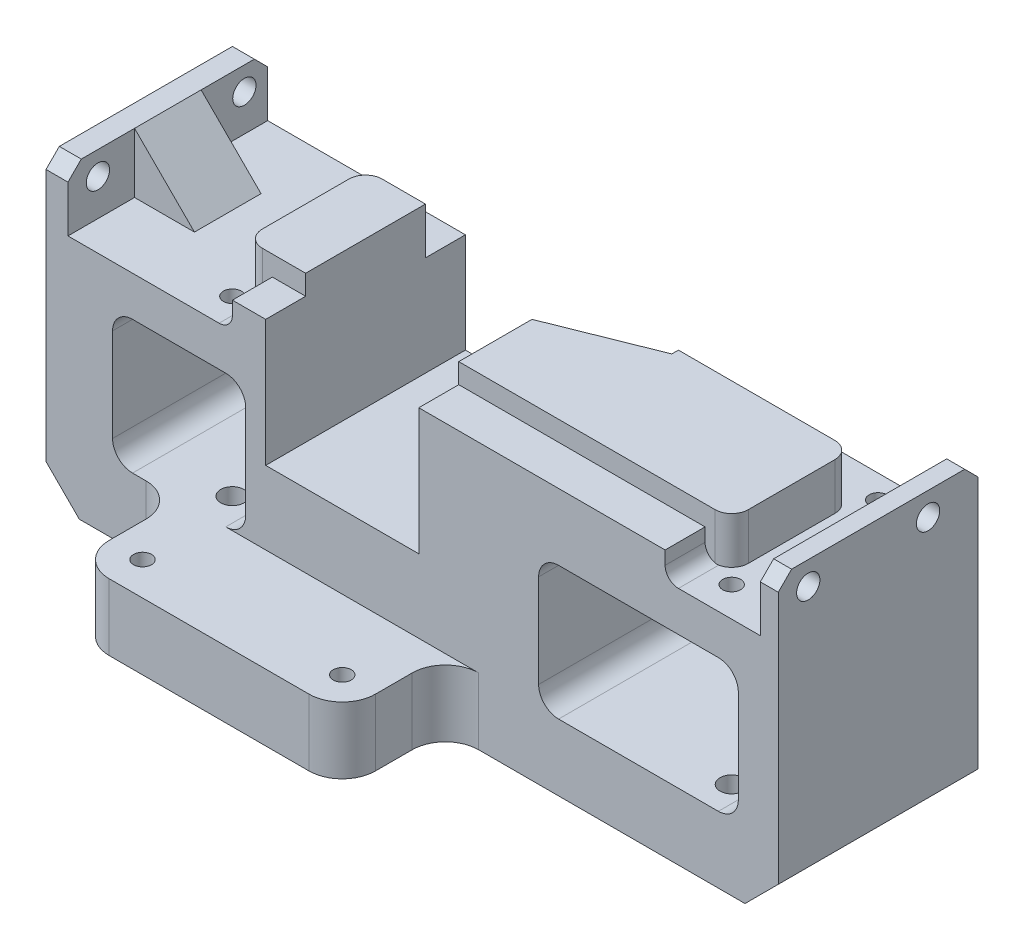
from build123d import *

# Parameters (mm, degrees)
SKETCH_1_R          = 1.35
EXTRUDE_1_DEPTH     = 10
SKETCH_2_W          = 110
SKETCH_2_H          = 30
EXTRUDE_2_DEPTH     = 26
CUT_EXTRUDE_1_DEPTH = 76.432088663
EXTRUDE_3_DEPTH     = 7
SKETCH_5_R          = 1.35
CUT_EXTRUDE_2_DEPTH = 7
SKETCH_6_W          = 65
SKETCH_6_H          = 6
EXTRUDE_4_DEPTH     = 4
SKETCH_7_W          = 3.3
SKETCH_7_H          = 30
SKETCH_7_W_2        = 2.7
EXTRUDE_5_DEPTH     = 9
RIB_1_REACH         = 79.332
SKETCH_8_WALL_W     = 169.39207434
SKETCH_8_WALL_H     = 10
RIB_2_REACH         = 79.332
SKETCH_9_WALL_W     = 167.056457124
SKETCH_9_WALL_H     = 10
CUT_EXTRUDE_3_REACH = 124.7
SKETCH_10_R         = 1.75
CUT_EXTRUDE_4_REACH = 124.7
SKETCH_11_R         = 1.75
FILLET_1_R          = 2
CUT_EXTRUDE_5_DEPTH = 22
CHAMFER_1_SIZE      = 5
CHAMFER_2_SIZE      = 2
SKETCH_13_R         = 1.75
CUT_EXTRUDE_6_DEPTH = 72.973953622
CHAMFER_3_SIZE      = 5
SKETCH_14_R         = 3
CUT_EXTRUDE_7_DEPTH = 4


with BuildPart() as part:
    # 草图1 → 凸台-拉伸1 (new body)
    with BuildSketch(Plane(origin=(0, 0, 0), x_dir=(1, 0, 0), z_dir=(0, 1, 0))):
        with BuildLine():
            Line((10, 15), (55, 15))
            Line((55, 15), (55, -15))
            Line((55, -15), (10, -15))
            ThreePointArc((10, -15), (6.464466094, -16.464466094), (5, -20))
            Line((5, -20), (5, -25.5))
            ThreePointArc((5, -25.5), (3.535533906, -29.035533906), (0, -30.5))
            Line((0, -30.5), (-30, -30.5))
            ThreePointArc((-30, -30.5), (-33.535533906, -29.035533906), (-35, -25.5))
            Line((-35, -25.5), (-35, -20))
            ThreePointArc((-35, -20), (-36.464466094, -16.464466094), (-40, -15))
            Line((-40, -15), (-55, -15))
            Line((-55, -15), (-55, 15))
            Line((-55, 15), (-40, 15))
            ThreePointArc((-40, 15), (-36.464466094, 16.464466094), (-35, 20))
            Line((-35, 20), (-35, 22))
            Line((-35, 22), (5, 22))
            Line((5, 22), (5, 20))
            ThreePointArc((5, 20), (6.464466094, 16.464466094), (10, 15))
        make_face()
        with Locations(Location((-30, 14.5, 0), (0, 0, 270))):
            Circle(SKETCH_1_R, mode=Mode.SUBTRACT)
        with Locations(Location((0, 14.5, 0), (0, 0, 270))):
            Circle(SKETCH_1_R, mode=Mode.SUBTRACT)
        with Locations(Location((0, -25.5, 0), (0, 0, 270))):
            Circle(SKETCH_1_R, mode=Mode.SUBTRACT)
        with Locations(Location((-30, -25.5, 0), (0, 0, 270))):
            Circle(SKETCH_1_R, mode=Mode.SUBTRACT)
    extrude(amount=EXTRUDE_1_DEPTH)

    # 草图2 → 凸台-拉伸2 (add)
    with BuildSketch(Plane(origin=(0, 10, 0), x_dir=(1, 0, 0), z_dir=(0, 1, 0))):
        Rectangle(SKETCH_2_W, SKETCH_2_H)
    extrude(amount=EXTRUDE_2_DEPTH)

    # 草图3 → 切除-拉伸1 (cut, through all)
    with BuildSketch(Plane.XY.offset(15)):
        with BuildLine():
            Line((-42, 30), (-28, 30))
            ThreePointArc((-28, 30), (-25.878679656, 29.121320344), (-25, 27))
            Line((-25, 27), (-25, 13))
            ThreePointArc((-25, 13), (-25.878679656, 10.878679656), (-28, 10))
            Line((-28, 10), (-42, 10))
            ThreePointArc((-42, 10), (-44.121320344, 10.878679656), (-45, 13))
            Line((-45, 13), (-45, 27))
            ThreePointArc((-45, 27), (-44.121320344, 29.121320344), (-42, 30))
        make_face()
        with BuildLine():
            Line((22, 10), (46, 10))
            ThreePointArc((46, 10), (48.121320344, 10.878679656), (49, 13))
            Line((49, 13), (49, 27))
            ThreePointArc((49, 27), (48.121320344, 29.121320344), (46, 30))
            Line((46, 30), (22, 30))
            ThreePointArc((22, 30), (19.878679656, 29.121320344), (19, 27))
            Line((19, 27), (19, 13))
            ThreePointArc((19, 13), (19.878679656, 10.878679656), (22, 10))
        make_face()
    extrude(amount=-CUT_EXTRUDE_1_DEPTH, mode=Mode.SUBTRACT)

    # 草图4 → 凸台-拉伸3 (add)
    with BuildSketch(Plane(origin=(0, 36, 0), x_dir=(1, 0, 0), z_dir=(0, 1, 0))):
        with BuildLine():
            Line((-28.5, 9), (39.5, 9))
            ThreePointArc((39.5, 9), (41.267766953, 8.267766953), (42, 6.5))
            Line((42, 6.5), (42, -6.5))
            ThreePointArc((42, -6.5), (41.267766953, -8.267766953), (39.5, -9))
            Line((39.5, -9), (-28.5, -9))
            ThreePointArc((-28.5, -9), (-30.267766953, -8.267766953), (-31, -6.5))
            Line((-31, -6.5), (-31, 6.5))
            ThreePointArc((-31, 6.5), (-30.267766953, 8.267766953), (-28.5, 9))
        make_face()
    extrude(amount=EXTRUDE_3_DEPTH)

    # 草图5 → 切除-拉伸2 (cut)
    with BuildSketch(Plane(origin=(0, 36, 0), x_dir=(1, 0, 0), z_dir=(0, 1, 0))):
        with Locations(Location((43.5, 11.5, 0), (0, 0, 270))):
            Circle(SKETCH_5_R)
        with Locations(Location((43.5, -10.5, 0), (0, 0, 270))):
            Circle(SKETCH_5_R)
        with Locations(Location((-31.5, -10.5, 0), (0, 0, 270))):
            Circle(SKETCH_5_R)
        with Locations(Location((-31.5, 11.5, 0), (0, 0, 270))):
            Circle(SKETCH_5_R)
    extrude(amount=-CUT_EXTRUDE_2_DEPTH, mode=Mode.SUBTRACT)

    # 草图6 → 凸台-拉伸4 (add)
    with BuildSketch(Plane(origin=(0, 36, 0), x_dir=(1, 0, 0), z_dir=(0, 1, 0))):
        with Locations((5.5, -12)):
            Rectangle(SKETCH_6_W, SKETCH_6_H)
    extrude(amount=EXTRUDE_4_DEPTH)

    # 草图7 → 凸台-拉伸5 (add)
    with BuildSketch(Plane(origin=(0, 36, 0), x_dir=(1, 0, 0), z_dir=(0, 1, 0))):
        with Locations((-53.35, 0)):
            Rectangle(SKETCH_7_W, SKETCH_7_H)
        with Locations((53.65, 0)):
            Rectangle(SKETCH_7_W_2, SKETCH_7_H)
    extrude(amount=EXTRUDE_5_DEPTH)

    # 草图8 wall → 筋1 (add, up to next)
    with BuildSketch(Plane(origin=(-47.2, 40.5, 0), x_dir=(0.707106781187, -0.707106781187, 0), z_dir=(0.707106781187, 0.707106781187, 0)), mode=Mode.PRIVATE) as rib_1_sk1:
        Rectangle(SKETCH_8_WALL_W, SKETCH_8_WALL_H)
    rib_1_tool1 = extrude(rib_1_sk1.sketch, amount=-RIB_1_REACH, mode=Mode.PRIVATE) - part.part
    add(rib_1_tool1.solids().sort_by_distance((-47.2, 40.5, 0))[0])

    # 草图9 wall → 筋2 (add, up to next)
    with BuildSketch(Plane(origin=(49.701923788, 40.5, 0), x_dir=(-0.500000000021, -0.866025403772, 0), z_dir=(0.866025403772, -0.500000000021, 0)), mode=Mode.PRIVATE) as rib_2_sk1:
        Rectangle(SKETCH_9_WALL_W, SKETCH_9_WALL_H)
    rib_2_tool1 = extrude(rib_2_sk1.sketch, amount=RIB_2_REACH, mode=Mode.PRIVATE) - part.part
    add(rib_2_tool1.solids().sort_by_distance((49.701923788, 40.5, 0))[0])

    # 草图10 → 切除-拉伸3 (cut, up to next)
    with BuildSketch(Plane(origin=(55, 0, 0), x_dir=(0, 0, -1), z_dir=(1, 0, 0)), mode=Mode.PRIVATE) as cut_extrude_3_sk1:
        with Locations((-10.5, 41.5)):
            Circle(SKETCH_10_R)
    cut_extrude_3_tool1 = extrude(cut_extrude_3_sk1.sketch, amount=-CUT_EXTRUDE_3_REACH, mode=Mode.PRIVATE) & part.part
    # 草图10 → 切除-拉伸3 (cut, up to next)
    with BuildSketch(Plane(origin=(55, 0, 0), x_dir=(0, 0, -1), z_dir=(1, 0, 0)), mode=Mode.PRIVATE) as cut_extrude_3_sk2:
        with Locations((7.5, 41.5)):
            Circle(SKETCH_10_R)
    cut_extrude_3_tool2 = extrude(cut_extrude_3_sk2.sketch, amount=-CUT_EXTRUDE_3_REACH, mode=Mode.PRIVATE) & part.part
    add(cut_extrude_3_tool1.solids().sort_by_distance((55, 41.5, 10.5))[0], mode=Mode.SUBTRACT)
    add(cut_extrude_3_tool2.solids().sort_by_distance((55, 41.5, -7.5))[0], mode=Mode.SUBTRACT)

    # 草图11 → 切除-拉伸4 (cut, up to next)
    with BuildSketch(Plane.ZY.offset(55), mode=Mode.PRIVATE) as cut_extrude_4_sk1:
        with Locations(Location((10.5, 41.5, 0), (0, 0, 180))):
            Circle(SKETCH_11_R)
    cut_extrude_4_tool1 = extrude(cut_extrude_4_sk1.sketch, amount=-CUT_EXTRUDE_4_REACH, mode=Mode.PRIVATE) & part.part
    # 草图11 → 切除-拉伸4 (cut, up to next)
    with BuildSketch(Plane.ZY.offset(55), mode=Mode.PRIVATE) as cut_extrude_4_sk2:
        with Locations((-11.5, 41.5)):
            Circle(SKETCH_11_R)
    cut_extrude_4_tool2 = extrude(cut_extrude_4_sk2.sketch, amount=-CUT_EXTRUDE_4_REACH, mode=Mode.PRIVATE) & part.part
    add(cut_extrude_4_tool1.solids().sort_by_distance((-55, 41.5, 10.5))[0], mode=Mode.SUBTRACT)
    add(cut_extrude_4_tool2.solids().sort_by_distance((-55, 41.5, -11.5))[0], mode=Mode.SUBTRACT)

    # 圆角1
    fillet_1_edges = [part.edges().sort_by_distance(p)[0] for p in [
        (-27, 36, 12),
        (38, 36, 12),
    ]]
    fillet(fillet_1_edges, radius=FILLET_1_R)

    # 草图12 → 切除-拉伸5 (cut)
    with BuildSketch(Plane(origin=(0, 43, 0), x_dir=(1, 0, 0), z_dir=(0, 1, 0))):
        Polygon((-22, -15), (-22, 15), (16, 15), (16, 8), (1, 2), (1, -15), align=None)
    extrude(amount=-CUT_EXTRUDE_5_DEPTH, mode=Mode.SUBTRACT)

    # 倒角1
    chamfer_1_edges = [part.edges().sort_by_distance(p)[0] for p in [
        (-55, 0, 0),
    ]]
    chamfer(chamfer_1_edges, length=CHAMFER_1_SIZE)

    # 倒角2
    chamfer_2_edges = [part.edges().sort_by_distance(p)[0] for p in [
        (-53.35, 45, 15),
        (-53.35, 45, -15),
        (53.65, 45, -15),
        (53.65, 45, 15),
    ]]
    chamfer(chamfer_2_edges, length=CHAMFER_2_SIZE)

    # 草图13 → 切除-拉伸6 (cut, through all)
    with BuildSketch(Plane(origin=(0, 10, 0), x_dir=(1, 0, 0), z_dir=(0, 1, 0))):
        with Locations(Location((43.5, 11.5, 0), (0, 0, 270))):
            Circle(SKETCH_13_R)
        with Locations(Location((43.5, -10.5, 0), (0, 0, 270))):
            Circle(SKETCH_13_R)
        with Locations(Location((-31.5, 11.5, 0), (0, 0, 270))):
            Circle(SKETCH_13_R)
        with Locations(Location((-31.5, -10.5, 0), (0, 0, 270))):
            Circle(SKETCH_13_R)
    extrude(amount=-CUT_EXTRUDE_6_DEPTH, mode=Mode.SUBTRACT)

    # 倒角3
    chamfer_3_edges = [part.edges().sort_by_distance(p)[0] for p in [
        (55, 0, 0),
    ]]
    chamfer(chamfer_3_edges, length=CHAMFER_3_SIZE)

    # 草图14 → 切除-拉伸7 (cut)
    with BuildSketch(Plane.XZ):
        with Locations((20, -14.5)):
            Circle(SKETCH_14_R)
    extrude(amount=-CUT_EXTRUDE_7_DEPTH, mode=Mode.SUBTRACT)


solid = part.part
